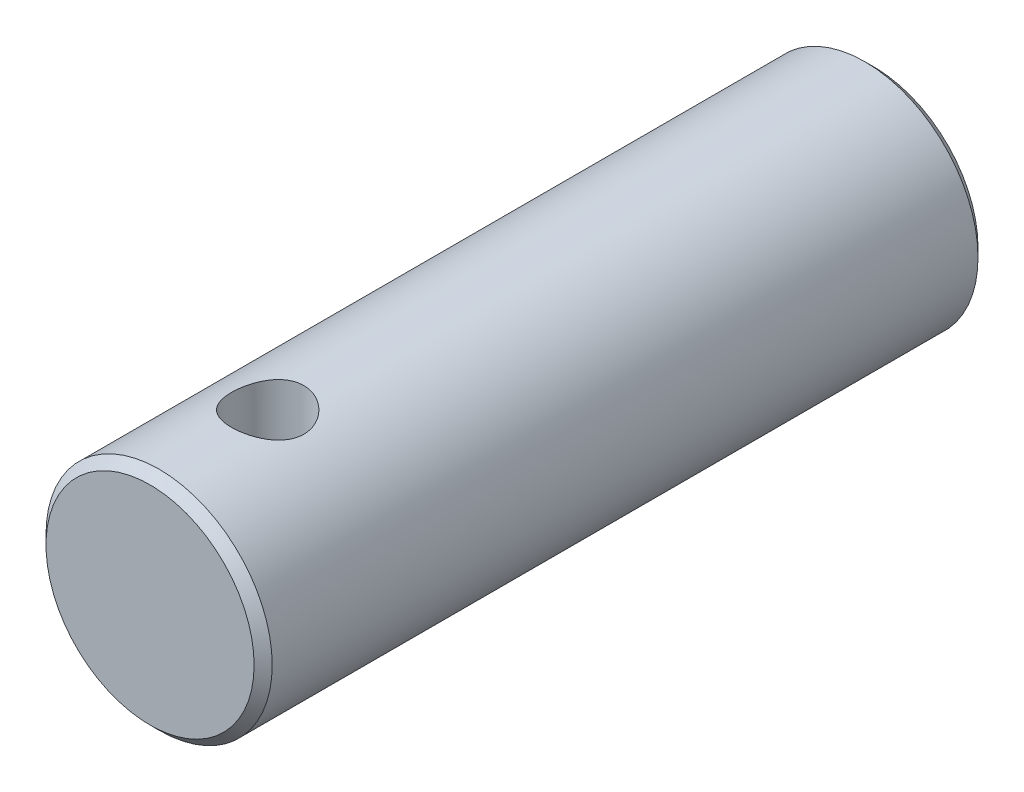
from build123d import *

# Parameters (mm, degrees)
SKETCH1_R           = 12.5
BOSS_EXTRUDE4_DEPTH = 80
SKETCH5_R           = 4
CUT_EXTRUDE4_DEPTH  = 8
CHAMFER5_SIZE       = 1


with BuildPart() as part:
    # Sketch1 → Boss-Extrude4 (new body)
    with BuildSketch(Plane.XY):
        Circle(SKETCH1_R)
    extrude(amount=BOSS_EXTRUDE4_DEPTH)

    # Sketch5 → Cut-Extrude4 (cut)
    with BuildSketch(Plane(origin=(0, 12.5, 0), x_dir=(1, 0, 0), z_dir=(0, 1, 0))):
        with Locations(Location((0, -67, 0), (0, 0, 270))):
            Circle(SKETCH5_R)
    extrude(amount=-CUT_EXTRUDE4_DEPTH, mode=Mode.SUBTRACT)

    # Chamfer5
    chamfer5_edges = [part.edges().sort_by_distance(p)[0] for p in [
        (-12.5, 0, 0),
        (-12.5, 0, 80),
    ]]
    chamfer(chamfer5_edges, length=CHAMFER5_SIZE)


solid = part.part
